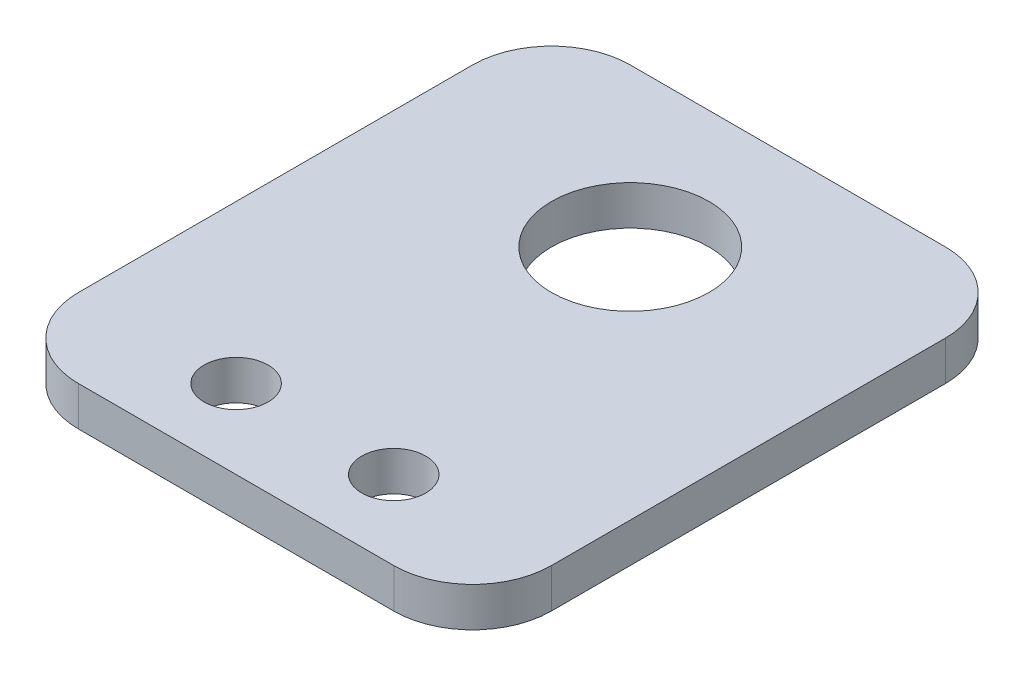
from build123d import *

# Parameters (mm, degrees)
BOSS_EXTRUDE1_DEPTH = 6.35
SKETCH2_R           = 12.7
SKETCH2_R_2         = 5.159375
CUT_EXTRUDE1_DEPTH  = 59.887477446


with BuildPart() as part:
    # Sketch1 → Boss-Extrude1 (new body)
    with BuildSketch(Plane(origin=(0, 0, 0), x_dir=(1, 0, 0), z_dir=(0, 1, 0))):
        with BuildLine():
            Line((-25.4, 44.45), (25.4, 44.45))
            ThreePointArc((25.4, 44.45), (34.380256121, 40.730256121), (38.1, 31.75))
            Line((38.1, 31.75), (38.1, -31.75))
            ThreePointArc((38.1, -31.75), (34.380256121, -40.730256121), (25.4, -44.45))
            Line((25.4, -44.45), (-25.4, -44.45))
            ThreePointArc((-25.4, -44.45), (-34.380256121, -40.730256121), (-38.1, -31.75))
            Line((-38.1, -31.75), (-38.1, 31.75))
            ThreePointArc((-38.1, 31.75), (-34.380256121, 40.730256121), (-25.4, 44.45))
        make_face()
    extrude(amount=BOSS_EXTRUDE1_DEPTH)

    # Sketch2 → Cut-Extrude1 (cut, through all)
    with BuildSketch(Plane(origin=(0, 6.35, 0), x_dir=(1, 0, 0), z_dir=(0, 1, 0))):
        with Locations(Location((0, 19.05, 0), (0, 0, 270))):
            Circle(SKETCH2_R)
        with Locations(Location((-12.7, -31.75, 0), (0, 0, 270))):
            Circle(SKETCH2_R_2)
        with Locations(Location((12.7, -31.75, 0), (0, 0, 90))):
            Circle(SKETCH2_R_2)
    extrude(amount=-CUT_EXTRUDE1_DEPTH, mode=Mode.SUBTRACT)


solid = part.part
